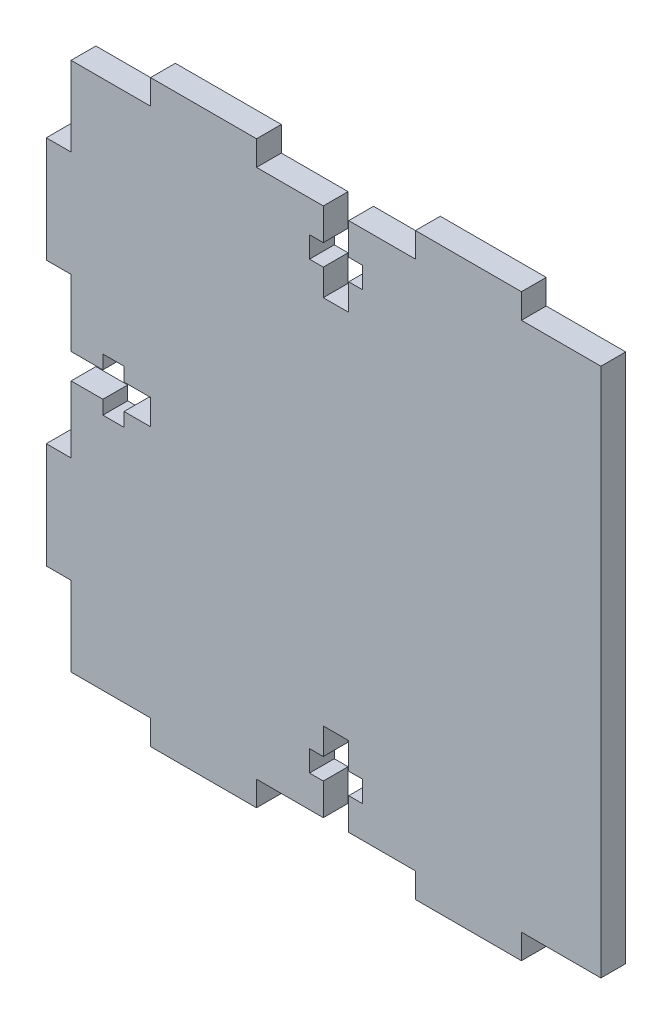
from build123d import *

# Parameters (mm, degrees)
SKETCH1_W           = 63.5
SKETCH1_H           = 63.5
BOSS_EXTRUDE1_DEPTH = 1.4859
CUT_EXTRUDE1_DEPTH  = 45.999517722
SKETCH3_W           = 12.7
SKETCH3_H           = 2.9718
SKETCH3_W_2         = 2.9718
SKETCH3_H_2         = 12.7
BOSS_EXTRUDE2_DEPTH = 2.9718


with BuildPart() as part:
    # Sketch1 → Boss-Extrude1 (new, symmetric)
    with BuildSketch(Plane.XY):
        Rectangle(SKETCH1_W, SKETCH1_H)
    extrude(amount=BOSS_EXTRUDE1_DEPTH, both=True)

    # Sketch2 → Cut-Extrude1 (cut, through all)
    with BuildSketch(Plane.XY.offset(1.4859)):
        Polygon((-1.524, -31.75), (-1.524, -27.94), (-3.175, -27.94), (-3.175, -25.4), (-1.524, -25.4), (-1.524, -22.225), (1.524, -22.225), (1.524, -25.4), (3.175, -25.4), (3.175, -27.94), (1.524, -27.94), (1.524, -31.75), align=None)
        Polygon((-31.75, 1.524), (-27.94, 1.524), (-27.94, 3.175), (-25.4, 3.175), (-25.4, 1.524), (-22.225, 1.524), (-22.225, -1.524), (-25.4, -1.524), (-25.4, -3.175), (-27.94, -3.175), (-27.94, -1.524), (-31.75, -1.524), align=None)
        Polygon((-1.524, 31.75), (-1.524, 27.94), (-3.175, 27.94), (-3.175, 25.4), (-1.524, 25.4), (-1.524, 22.225), (1.524, 22.225), (1.524, 25.4), (3.175, 25.4), (3.175, 27.94), (1.524, 27.94), (1.524, 31.75), align=None)
    extrude(amount=-CUT_EXTRUDE1_DEPTH, mode=Mode.SUBTRACT)

    # Sketch3 → Boss-Extrude2 (add)
    with BuildSketch(Plane.XY.offset(1.4859)):
        with Locations((-15.875, -33.2359)):
            Rectangle(SKETCH3_W, SKETCH3_H)
        with Locations((15.875, -33.2359)):
            Rectangle(SKETCH3_W, SKETCH3_H)
        with Locations((-33.2359, 15.875)):
            Rectangle(SKETCH3_W_2, SKETCH3_H_2)
        with Locations((-33.2359, -15.875)):
            Rectangle(SKETCH3_W_2, SKETCH3_H_2)
        with Locations((15.875, 33.2359)):
            Rectangle(SKETCH3_W, SKETCH3_H)
        with Locations((-15.875, 33.2359)):
            Rectangle(SKETCH3_W, SKETCH3_H)
    extrude(amount=-BOSS_EXTRUDE2_DEPTH)


solid = part.part
